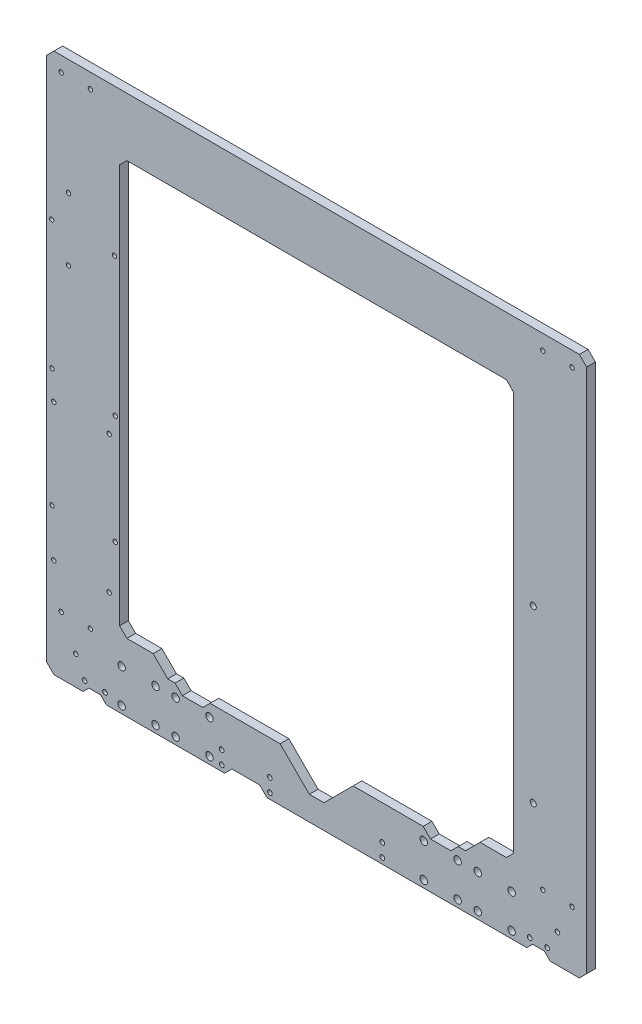
from build123d import *

# Parameters (mm, degrees)
SKICA1_R                = 2.55
SKICA1_R_2              = 1.5
SKICA1_R_3              = 1.6
SKICA1_R_4              = 2.1
P_IDAT_VYSUNUT_M1_DEPTH = 6


with BuildPart() as part:
    # Skica1 → Přidat vysunutím1 (new body)
    with BuildSketch(Plane.XY):
        Polygon((41, 0), (122, 0), (127, 5), (146, 5), (151, 0), (329, 0), (333, 4), (341, 4), (345, 0), (365, 0), (370, 5), (370, 365), (365, 370), (5, 370), (0, 365), (0, 5), (5, 0), (25, 0), (29, 4), (37, 4), align=None)
        with Locations((111.6, 4.9)):
            Circle(SKICA1_R, mode=Mode.SUBTRACT)
        with Locations((111.6, 28.1)):
            Circle(SKICA1_R, mode=Mode.SUBTRACT)
        with Locations((258.4, 28.1)):
            Circle(SKICA1_R, mode=Mode.SUBTRACT)
        with Locations((258.4, 4.9)):
            Circle(SKICA1_R, mode=Mode.SUBTRACT)
        with Locations((88.4, 28.1)):
            Circle(SKICA1_R, mode=Mode.SUBTRACT)
        with Locations((88.4, 4.9)):
            Circle(SKICA1_R, mode=Mode.SUBTRACT)
        with Locations((74.6, 4.9)):
            Circle(SKICA1_R, mode=Mode.SUBTRACT)
        with Locations((74.6, 28.1)):
            Circle(SKICA1_R, mode=Mode.SUBTRACT)
        with Locations((51.4, 28.1)):
            Circle(SKICA1_R, mode=Mode.SUBTRACT)
        with Locations((51.4, 4.9)):
            Circle(SKICA1_R, mode=Mode.SUBTRACT)
        with Locations((281.6, 28.1)):
            Circle(SKICA1_R, mode=Mode.SUBTRACT)
        with Locations((281.6, 4.9)):
            Circle(SKICA1_R, mode=Mode.SUBTRACT)
        with Locations((295.4, 4.9)):
            Circle(SKICA1_R, mode=Mode.SUBTRACT)
        with Locations((318.6, 4.9)):
            Circle(SKICA1_R, mode=Mode.SUBTRACT)
        with Locations((318.6, 28.1)):
            Circle(SKICA1_R, mode=Mode.SUBTRACT)
        with Locations((295.4, 28.1)):
            Circle(SKICA1_R, mode=Mode.SUBTRACT)
        with Locations((3.7, 99.8)):
            Circle(SKICA1_R_2, mode=Mode.SUBTRACT)
        with Locations((47, 99.8)):
            Circle(SKICA1_R_2, mode=Mode.SUBTRACT)
        with Locations((42.9, 67.8)):
            Circle(SKICA1_R_2, mode=Mode.SUBTRACT)
        with Locations((4.9, 67.8)):
            Circle(SKICA1_R_2, mode=Mode.SUBTRACT)
        with Locations((30, 39.8)):
            Circle(SKICA1_R_2, mode=Mode.SUBTRACT)
        with Locations((10, 39.8)):
            Circle(SKICA1_R_2, mode=Mode.SUBTRACT)
        with Locations((20, 19.8)):
            Circle(SKICA1_R_2, mode=Mode.SUBTRACT)
        with Locations((340, 39.8)):
            Circle(SKICA1_R_2, mode=Mode.SUBTRACT)
        with Locations((360, 39.8)):
            Circle(SKICA1_R_2, mode=Mode.SUBTRACT)
        with Locations((340, 359.8)):
            Circle(SKICA1_R_2, mode=Mode.SUBTRACT)
        with Locations((360, 359.8)):
            Circle(SKICA1_R_2, mode=Mode.SUBTRACT)
        with Locations((10, 359.8)):
            Circle(SKICA1_R_2, mode=Mode.SUBTRACT)
        with Locations((30, 359.8)):
            Circle(SKICA1_R_2, mode=Mode.SUBTRACT)
        with Locations((15, 247.8)):
            Circle(SKICA1_R_2, mode=Mode.SUBTRACT)
        with Locations((3.5, 269.3)):
            Circle(SKICA1_R_2, mode=Mode.SUBTRACT)
        with Locations((46.5, 269.3)):
            Circle(SKICA1_R_2, mode=Mode.SUBTRACT)
        with Locations((15, 290.8)):
            Circle(SKICA1_R_2, mode=Mode.SUBTRACT)
        with Locations((4.9, 161.8)):
            Circle(SKICA1_R_2, mode=Mode.SUBTRACT)
        with Locations((3.7, 181.1)):
            Circle(SKICA1_R_2, mode=Mode.SUBTRACT)
        with Locations((42.9, 161.8)):
            Circle(SKICA1_R_2, mode=Mode.SUBTRACT)
        with Locations((47, 174.7)):
            Circle(SKICA1_R_2, mode=Mode.SUBTRACT)
        with Locations((26, 7)):
            Circle(SKICA1_R_3, mode=Mode.SUBTRACT)
        with Locations((40, 7)):
            Circle(SKICA1_R_3, mode=Mode.SUBTRACT)
        with Locations((120, 4)):
            Circle(SKICA1_R_3, mode=Mode.SUBTRACT)
        with Locations((120, 13)):
            Circle(SKICA1_R_3, mode=Mode.SUBTRACT)
        with Locations((153, 13)):
            Circle(SKICA1_R_3, mode=Mode.SUBTRACT)
        with Locations((153, 4)):
            Circle(SKICA1_R_3, mode=Mode.SUBTRACT)
        with Locations((230, 13)):
            Circle(SKICA1_R_3, mode=Mode.SUBTRACT)
        with Locations((230, 4)):
            Circle(SKICA1_R_3, mode=Mode.SUBTRACT)
        with Locations((331, 7)):
            Circle(SKICA1_R_3, mode=Mode.SUBTRACT)
        with Locations((343, 7)):
            Circle(SKICA1_R_3, mode=Mode.SUBTRACT)
        with Locations((350, 19.8)):
            Circle(SKICA1_R_3, mode=Mode.SUBTRACT)
        with Locations((333.4, 88)):
            Circle(SKICA1_R_4, mode=Mode.SUBTRACT)
        with Locations((333.4, 205)):
            Circle(SKICA1_R_4, mode=Mode.SUBTRACT)
        Polygon((320, 51.5), (320, 325), (315, 330), (55, 330), (50, 325), (50, 51.5), (55, 46.5), (73, 46.5), (83, 36.5), (88, 36.5), (93, 31.5), (107, 31.5), (112, 36.5), (160, 36.5), (180, 16.5), (190, 16.5), (210, 36.5), (258, 36.5), (263, 31.5), (277, 31.5), (282, 36.5), (287, 36.5), (297, 46.5), (315, 46.5), align=None, mode=Mode.SUBTRACT)
    extrude(amount=-P_IDAT_VYSUNUT_M1_DEPTH)


solid = part.part
